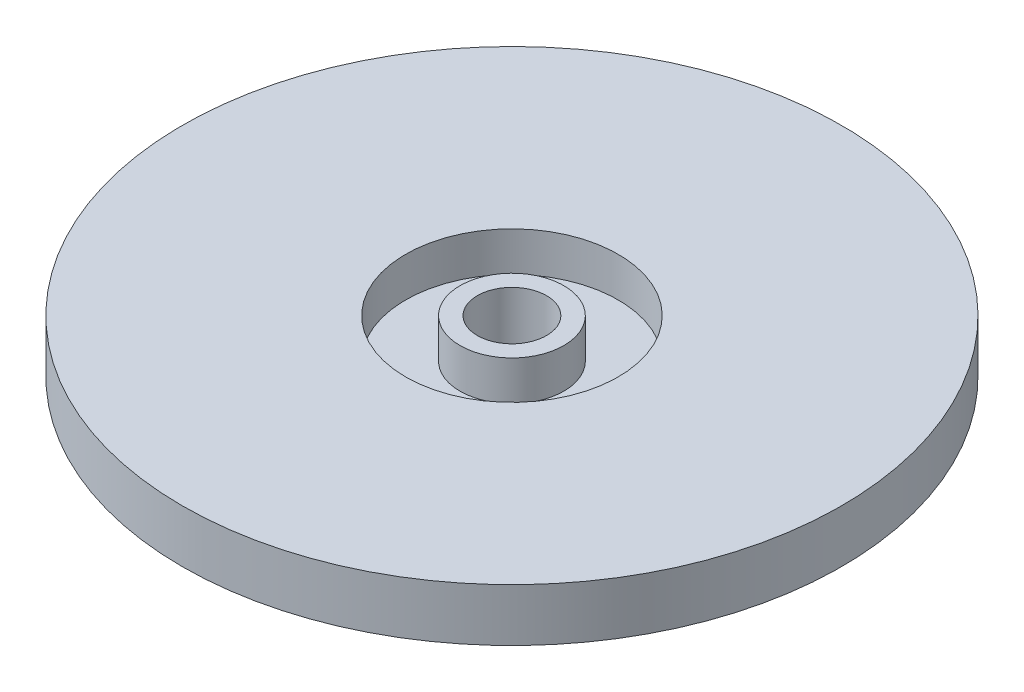
from build123d import *

# Parameters (mm, degrees)
SKETCH1_R           = 50
BOSS_EXTRUDE1_DEPTH = 4
SKETCH2_R           = 16.125
SKETCH2_R_2         = 7.875
CUT_EXTRUDE1_DEPTH  = 6
SKETCH3_R           = 5.25
CUT_EXTRUDE2_DEPTH  = 72.161787499
SKETCH4_R           = 15.25
SKETCH4_R_2         = 10.25
BOSS_EXTRUDE2_DEPTH = 20


with BuildPart() as part:
    # Sketch1 → Boss-Extrude1 (new, symmetric)
    with BuildSketch(Plane(origin=(0, 0, 0), x_dir=(1, 0, 0), z_dir=(0, 1, 0))):
        with Locations(Location((0, 0, 0), (0, 0, 270))):
            Circle(SKETCH1_R)
    extrude(amount=BOSS_EXTRUDE1_DEPTH, both=True)

    # Sketch2 → Cut-Extrude1 (cut)
    with BuildSketch(Plane(origin=(0, 4, 0), x_dir=(1, 0, 0), z_dir=(0, 1, 0))):
        with Locations(Location((0, 0, 0), (0, 0, 270))):
            Circle(SKETCH2_R)
        with Locations(Location((0, 0, 0), (0, 0, 270))):
            Circle(SKETCH2_R_2, mode=Mode.SUBTRACT)
    extrude(amount=-CUT_EXTRUDE1_DEPTH, mode=Mode.SUBTRACT)

    # Sketch3 → Cut-Extrude2 (cut, through all)
    with BuildSketch(Plane(origin=(0, 4, 0), x_dir=(1, 0, 0), z_dir=(0, 1, 0))):
        with Locations(Location((0, 0, 0), (0, 0, 270))):
            Circle(SKETCH3_R)
    extrude(amount=-CUT_EXTRUDE2_DEPTH, mode=Mode.SUBTRACT)

    # Sketch4 → Boss-Extrude2 (add)
    with BuildSketch(Plane.XZ.offset(4)):
        with Locations(Location((0, 0, 0), (0, 0, 90))):
            Circle(SKETCH4_R)
        with Locations(Location((0, 0, 0), (0, 0, 270))):
            Circle(SKETCH4_R_2, mode=Mode.SUBTRACT)
    extrude(amount=BOSS_EXTRUDE2_DEPTH)


solid = part.part
